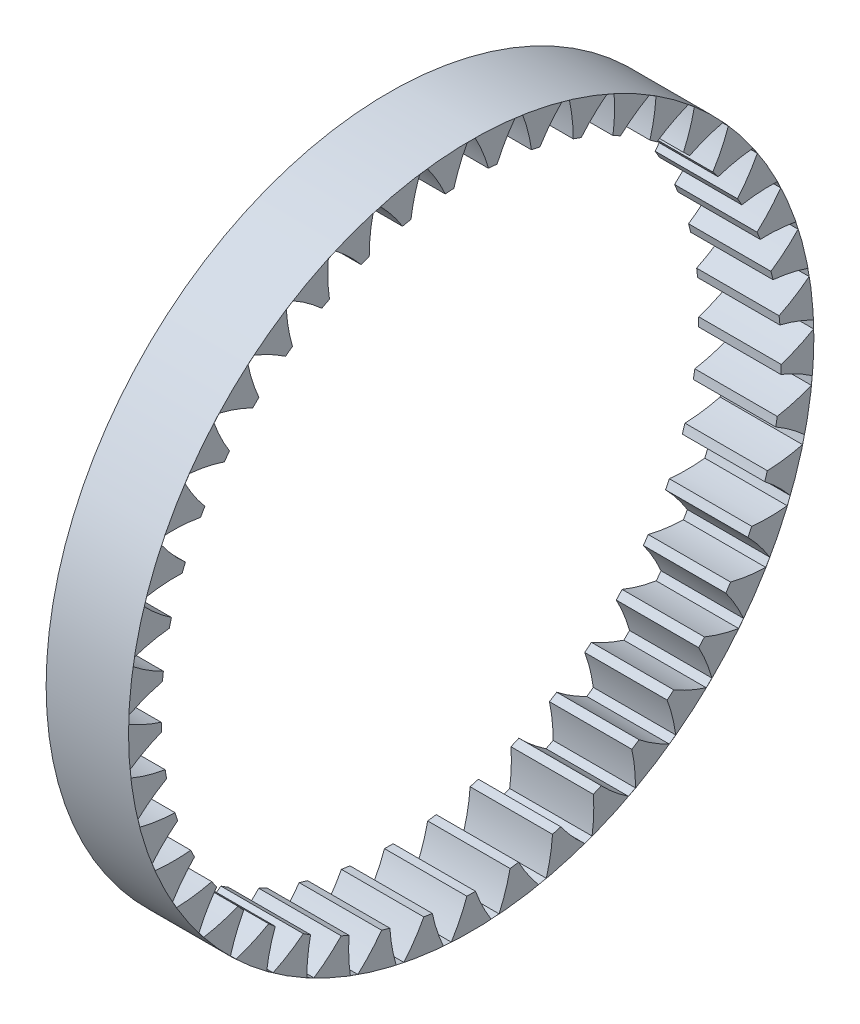
from build123d import *

# Parameters (mm, degrees)
BASPROSKE_W     = 10
BASPROSKE_H     = 3.9639
TOOTHCUT_DEPTH  = 60.659644706
TEETHCUTS_COUNT = 45
TEETHCUTS_ANGLE = 352


with BuildPart() as part:
    # BasProSke → Base-Revolve (revolve)
    with BuildSketch(Plane(origin=(0, 0, 0), x_dir=(1, 0, 0), z_dir=(0, 1, 0)), mode=Mode.PRIVATE) as base_revolve_sk:
        with Locations((5, 39.60695)):
            Rectangle(BASPROSKE_W, BASPROSKE_H)
    revolve(base_revolve_sk.sketch.rotate(Axis((-10, 0, 0), (1, 0, 0)), 180), axis=Axis((-10, 0, 0), (1, 0, 0)))

    # TooCutSke → ToothCut (cut, through all)
    with BuildSketch(Plane(origin=(0, 0, 0), x_dir=(0, 0, -1), z_dir=(1, 0, 0))):
        with BuildLine():
            ThreePointArc((2.110844515, 37.540301752), (1.407646344, 39.595489653), (0.48232054, 41.560701379))
            ThreePointArc((0.48232054, 41.560701379), (0, 41.5635), (-0.48232054, 41.560701379))
            ThreePointArc((-0.48232054, 41.560701379), (-1.407646344, 39.595489653), (-2.110844515, 37.540301752))
            ThreePointArc((-2.110844515, 37.540301752), (0, 37.5996), (2.110844515, 37.540301752))
        make_face()
    toothcut = extrude(amount=TOOTHCUT_DEPTH, mode=Mode.SUBTRACT)

    # TeethCuts: ToothCut ×45 about axis
    teethcuts_axis = Axis((-10, 0, 0), (1, 0, 0))
    for i in range(1, TEETHCUTS_COUNT):
        add(toothcut.rotate(teethcuts_axis, i * TEETHCUTS_ANGLE / (TEETHCUTS_COUNT - 1)), mode=Mode.SUBTRACT)


solid = part.part
